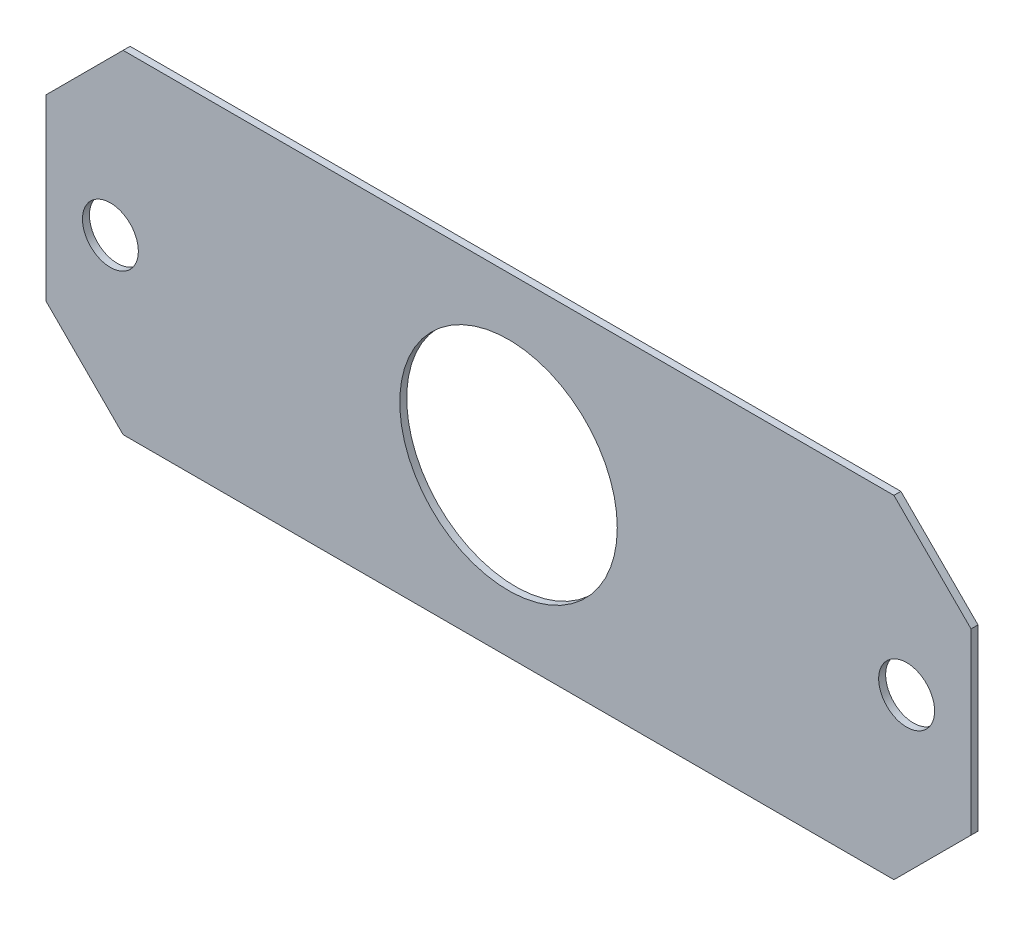
from build123d import *

# Parameters (mm, degrees)
BOSS_EXTRUDE1_DEPTH   = 0.4064
F_4_CLEARANCE_HOLE1_D = 3.2639
SKETCH5_R             = 6.35
CUT_EXTRUDE1_DEPTH    = 0.4064


with BuildPart() as part:
    # Sketch1 → Boss-Extrude1 (new body)
    with BuildSketch(Plane.XY):
        Polygon((22.499532885, 9.7155), (27.0002, 5.214832885), (27.0002, -5.214832885), (22.499532885, -9.7155), (-22.499532885, -9.7155), (-27.0002, -5.214832885), (-27.0002, 5.214832885), (-22.499532885, 9.7155), align=None)
    extrude(amount=BOSS_EXTRUDE1_DEPTH)

    # #4 Clearance Hole1 (through all)
    with Locations(Plane.XY.offset(0.4064)):
        with Locations((-23.241, 0), (23.241, 0)):
            Hole(F_4_CLEARANCE_HOLE1_D / 2)

    # Sketch5 → Cut-Extrude1 (cut)
    with BuildSketch(Plane.XY.offset(0.4064)):
        Circle(SKETCH5_R)
    extrude(amount=-CUT_EXTRUDE1_DEPTH, mode=Mode.SUBTRACT)


solid = part.part
